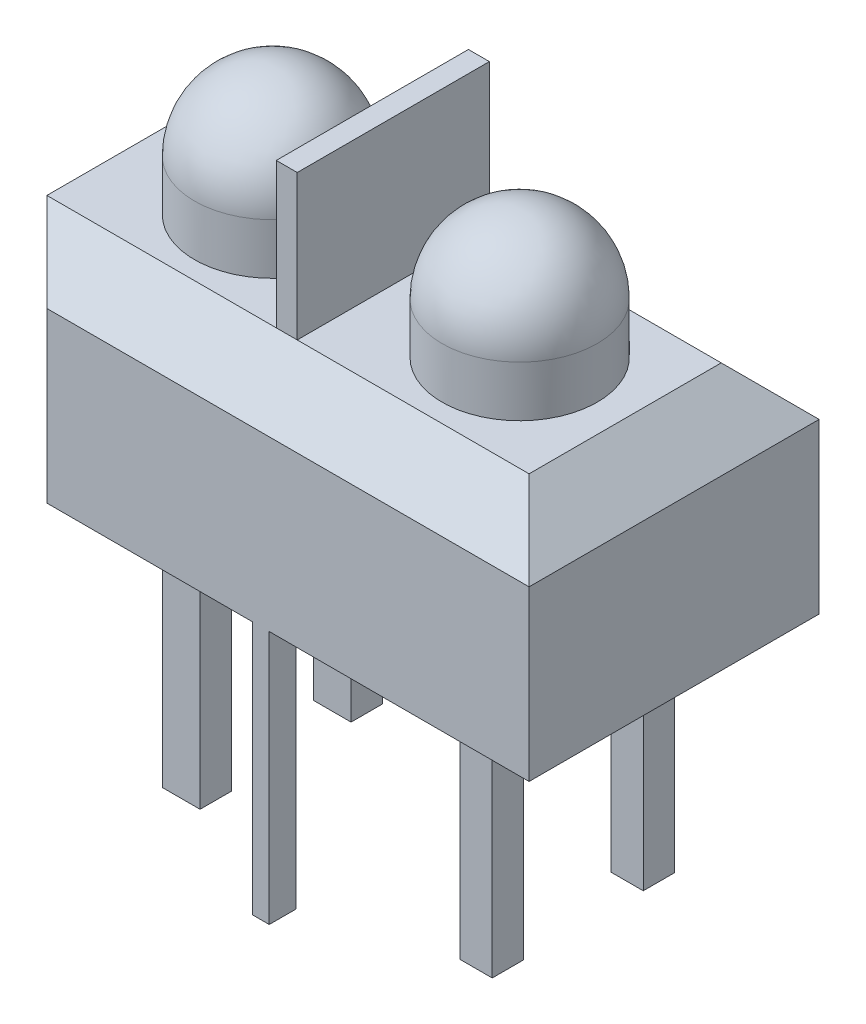
from build123d import *

# Parameters (mm, degrees)
SKETCH_1_W          = 8
SKETCH_1_H          = 4
EXTRUDE_1_DEPTH     = 3
CUT_EXTRUDE_1_DEPTH = 10
CUT_EXTRUDE_2_DEPTH = 10
CUT_EXTRUDE_3_DEPTH = 10
SKETCH_5_W          = 0.28903002
SKETCH_5_H          = 2.650043114
EXTRUDE_2_DEPTH     = 2
SKETCH_6_R          = 1.074823955
EXTRUDE_3_DEPTH     = 0.7
SKETCH_8_R          = 1.07
EXTRUDE_4_DEPTH     = 0.7
SKETCH_13_W         = 0.51855386
SKETCH_13_H         = 0.433545031
SKETCH_13_W_2       = 0.442045914
EXTRUDE_5_DEPTH     = 3.5
SKETCH_14_W         = 0.22952384
SKETCH_14_H         = 0.414585327
EXTRUDE_6_DEPTH     = 3.5


with BuildPart() as part:
    # 草图1 → 凸台-拉伸1 (new body)
    with BuildSketch(Plane(origin=(0, 0, 0), x_dir=(1, 0, 0), z_dir=(0, 1, 0))):
        Rectangle(SKETCH_1_W, SKETCH_1_H)
    extrude(amount=EXTRUDE_1_DEPTH)

    # 草图2 → 切除-拉伸1 (cut)
    with BuildSketch(Plane.ZY.offset(4)):
        Polygon((-2, 2.325021557), (-1.325021557, 3), (-2, 3), align=None)
        Polygon((2, 2.325021557), (1.325021557, 3), (2, 3), align=None)
    extrude(amount=-CUT_EXTRUDE_1_DEPTH, mode=Mode.SUBTRACT)

    # 草图3 → 切除-拉伸2 (cut)
    with BuildSketch(Plane.XY.offset(2)):
        Polygon((-4, 2.325021557), (-3.325021557, 3), (-4, 3), align=None)
        Polygon((4, 2.325021557), (3.325021557, 3), (4, 3), align=None)
    extrude(amount=-CUT_EXTRUDE_2_DEPTH, mode=Mode.SUBTRACT)

    # 草图4 → 切除-拉伸3 (cut)
    with BuildSketch(Plane(origin=(0, 3, 0), x_dir=(1, 0, 0), z_dir=(0, 1, 0))):
        Polygon((-3.325021557, 1.325021557), (-2.650043113, 2), (-4, 2), (-4, 0.650043113), align=None)
        Polygon((-3.325021557, -1.325021557), (-2.650043113, -2), (-4, -2), (-4, -0.650043113), align=None)
    extrude(amount=-CUT_EXTRUDE_3_DEPTH, mode=Mode.SUBTRACT)

    # 草图5 → 凸台-拉伸2 (add)
    with BuildSketch(Plane(origin=(0, 3, 0), x_dir=(1, 0, 0), z_dir=(0, 1, 0))):
        with Locations((-0.017001766, 0)):
            Rectangle(SKETCH_5_W, SKETCH_5_H)
    extrude(amount=EXTRUDE_2_DEPTH)

    # 草图6 → 凸台-拉伸3 (add)
    with BuildSketch(Plane(origin=(0, 3, 0), x_dir=(1, 0, 0), z_dir=(0, 1, 0))):
        with Locations(Location((-1.538659816, 0, 0), (0, 0, 90))):
            Circle(SKETCH_6_R)
    extrude(amount=EXTRUDE_3_DEPTH)

    # 草图7 → 旋转1 (revolve)
    with BuildSketch(Plane(origin=(0, 3.7, 0), x_dir=(1, 0, 0), z_dir=(0, 1, 0))):
        with BuildLine():
            Line((-0.463835861, 0), (-2.613483771, 0))
            ThreePointArc((-2.613483771, 0), (-1.538659816, -1.074823955), (-0.463835861, 0))
        make_face()
    revolve(axis=Axis((-0.463835861, 3.7, 0), (-1, 0, 0)))

    # 草图8 → 凸台-拉伸4 (add)
    with BuildSketch(Plane(origin=(0, 3, 0), x_dir=(1, 0, 0), z_dir=(0, 1, 0))):
        with Locations(Location((1.870194252, 0, 0), (0, 0, 90))):
            Circle(SKETCH_8_R)
    extrude(amount=EXTRUDE_4_DEPTH)

    # 草图12 → 旋转2 (revolve)
    with BuildSketch(Plane(origin=(0, 3.7, 0), x_dir=(1, 0, 0), z_dir=(0, 1, 0))):
        with BuildLine():
            Line((0.800194252, 0), (2.940194252, 0))
            ThreePointArc((2.940194252, 0), (1.870194252, -1.07), (0.800194252, 0))
        make_face()
    revolve(axis=Axis((0.800194252, 3.7, 0), (1, 0, 0)))

    # 草图13 → 凸台-拉伸5 (add)
    with BuildSketch(Plane.XZ):
        with Locations((-1.695926151, 0.884091829)):
            Rectangle(SKETCH_13_W, SKETCH_13_H)
        with Locations((-1.695926151, -1.198624497)):
            Rectangle(SKETCH_13_W, SKETCH_13_H)
        with Locations((2.371746347, 0.884091829)):
            Rectangle(SKETCH_13_W_2, SKETCH_13_H)
        with Locations((2.371746347, -1.198624497)):
            Rectangle(SKETCH_13_W_2, SKETCH_13_H)
    extrude(amount=EXTRUDE_5_DEPTH)

    # 草图14 → 凸台-拉伸6 (add)
    with BuildSketch(Plane.XZ):
        Polygon((0.187019425, 2), (0.187019425, 1.627919087), (0.416543265, 1.627919087), (0.416543265, 1.942451757), (0.416543265, 2), align=None)
        with Locations((0.301781345, -1.792707336)):
            Rectangle(SKETCH_14_W, SKETCH_14_H)
    extrude(amount=EXTRUDE_6_DEPTH)


solid = part.part
